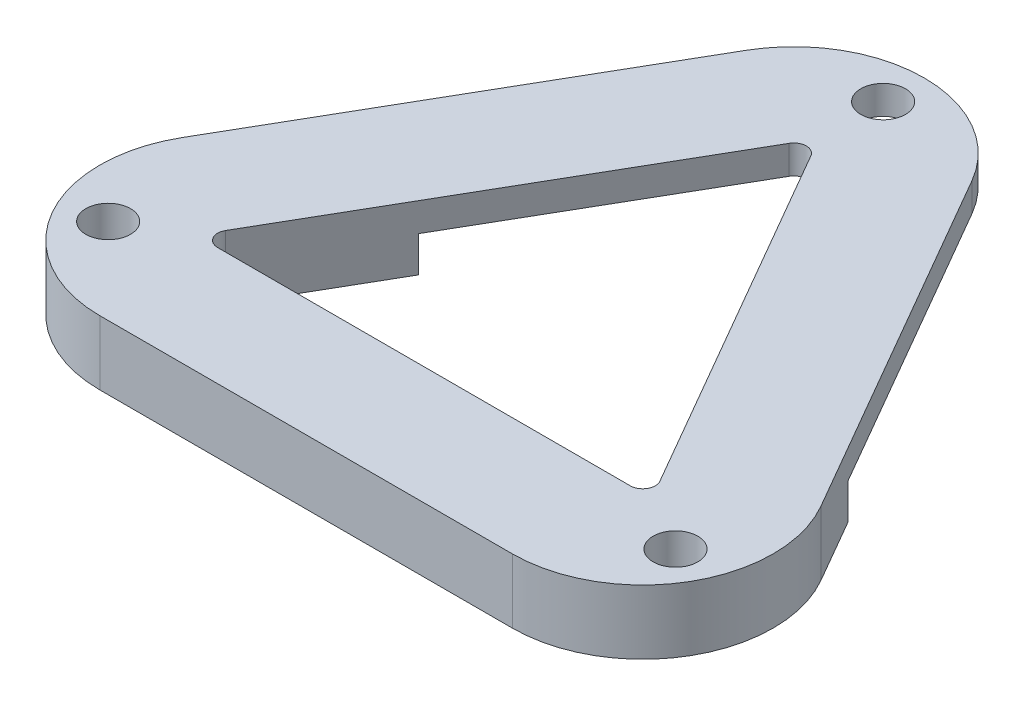
from build123d import *

# Parameters (mm, degrees)
EXTRUDE_THIN1_DEPTH = 11.43
SKETCH2_R           = 3.96875
CUT_EXTRUDE1_DEPTH  = 87.407822566
SKETCH3_W           = 127
SKETCH3_H           = 76.2
CUT_EXTRUDE2_DEPTH  = 6.35


with BuildPart() as part:
    # Sketch1 → Extrude-Thin1 (new body)
    with BuildSketch(Plane(origin=(0, 0, 0), x_dir=(1, 0, 0), z_dir=(0, 1, 0))):
        with BuildLine():
            Line((-36.661742094, -61.2775), (36.661742094, -61.2775))
            ThreePointArc((36.661742094, -61.2775), (56.73404589, -49.68875), (56.73404589, -26.51125))
            Line((56.73404589, -26.51125), (20.072303796, 36.98875))
            ThreePointArc((20.072303796, 36.98875), (0, 48.5775), (-20.072303796, 36.98875))
            Line((-20.072303796, 36.98875), (-56.73404589, -26.51125))
            ThreePointArc((-56.73404589, -26.51125), (-56.73404589, -49.68875), (-36.661742094, -61.2775))
        make_face()
        with BuildLine():
            Line((-36.661742094, -40.3225), (36.661742094, -40.3225))
            ThreePointArc((36.661742094, -40.3225), (38.586483553, -39.21125), (38.586483553, -36.98875))
            Line((38.586483553, -36.98875), (1.92474146, 26.51125))
            ThreePointArc((1.92474146, 26.51125), (0, 27.6225), (-1.92474146, 26.51125))
            Line((-1.92474146, 26.51125), (-38.586483553, -36.98875))
            ThreePointArc((-38.586483553, -36.98875), (-38.586483553, -39.21125), (-36.661742094, -40.3225))
        make_face(mode=Mode.SUBTRACT)
    extrude(amount=EXTRUDE_THIN1_DEPTH)

    # Sketch2 → Cut-Extrude1 (cut, through all)
    with BuildSketch(Plane(origin=(0, 0, 0), x_dir=(1, 0, 0), z_dir=(0, 1, 0))):
        with Locations((-50.409895379, -46.0375)):
            Circle(SKETCH2_R)
        with Locations((0, 41.275)):
            Circle(SKETCH2_R)
        with Locations((50.409895379, -46.0375)):
            Circle(SKETCH2_R)
    extrude(amount=CUT_EXTRUDE1_DEPTH, mode=Mode.SUBTRACT)

    # Sketch3 → Cut-Extrude2 (cut)
    with BuildSketch(Plane(origin=(0, 0, 0), x_dir=(1, 0, 0), z_dir=(0, 1, 0))):
        with Locations((0, 22.86)):
            Rectangle(SKETCH3_W, SKETCH3_H)
    extrude(amount=CUT_EXTRUDE2_DEPTH, mode=Mode.SUBTRACT)


solid = part.part
